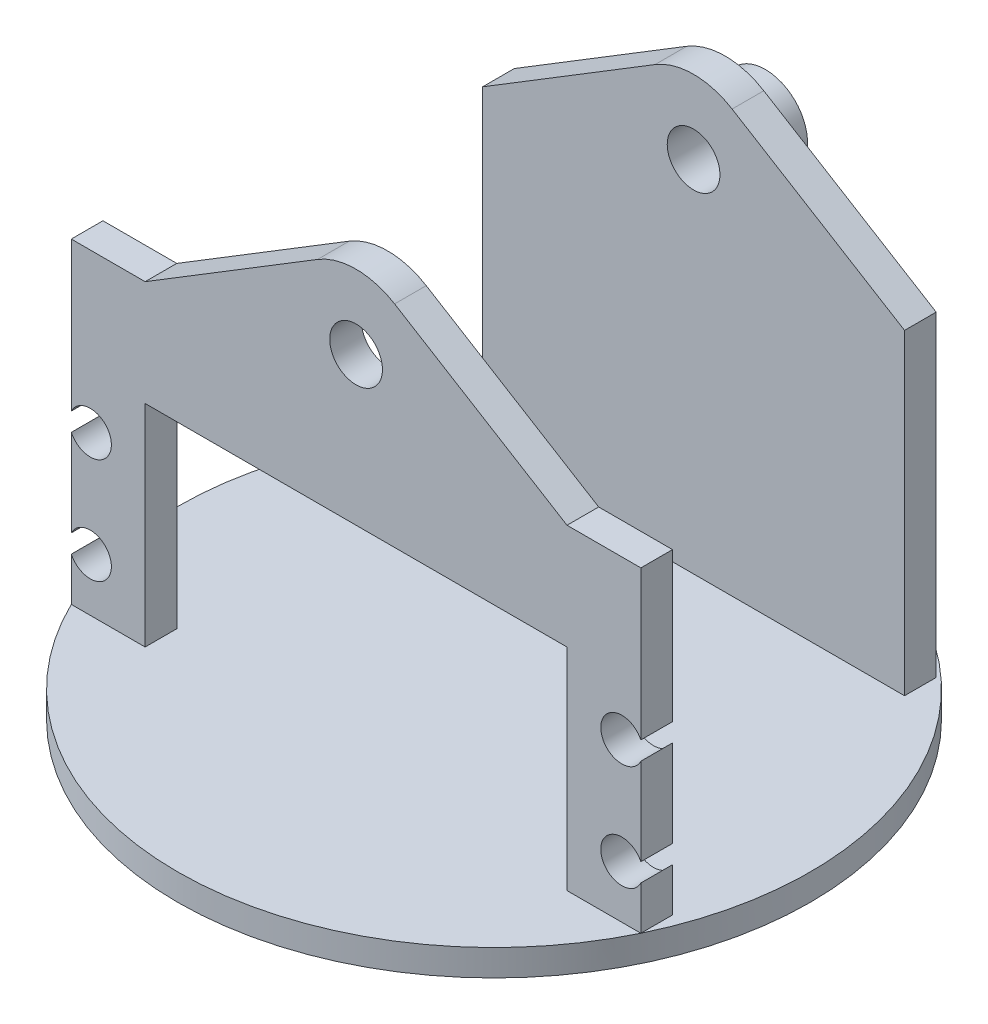
from build123d import *

# Parameters (mm, degrees)
CROQUIS2_W              = 54
CROQUIS2_H              = 3
SALIENTE_EXTRUIR1_DEPTH = 30
CORTAR_EXTRUIR1_REACH   = 63.478
CROQUIS3_W              = 40
CROQUIS3_H              = 20
CORTAR_EXTRUIR2_DEPTH   = 10
CROQUIS5_R              = 2.5
SALIENTE_EXTRUIR2_DEPTH = 3
CROQUIS6_R              = 2.5
SALIENTE_EXTRUIR3_DEPTH = 3
CROQUIS7_R              = 4
CROQUIS7_R_2            = 2.5
SALIENTE_EXTRUIR4_DEPTH = 1.8
CROQUIS8_R              = 4
SALIENTE_EXTRUIR5_DEPTH = 2


with BuildPart() as part:
    # Croquis1 → Revolución1 (revolve)
    with BuildSketch(Plane.XY):
        Polygon((0, 0), (0, 2), (-30, 2), (-30, -0.5), (-5.5, -0.5), (-5.5, -2.75), (-2.9, -2.75), (-2.9, 0), align=None)
    revolve(axis=Axis((0, 5.26927704, 0), (0, -1, 0)))

    # Croquis2 → Saliente-Extruir1 (add)
    with BuildSketch(Plane(origin=(0, 2, 0), x_dir=(1, 0, 0), z_dir=(0, 1, 0))):
        with Locations((0, -11.576696831)):
            Rectangle(CROQUIS2_W, CROQUIS2_H)
    extrude(amount=SALIENTE_EXTRUIR1_DEPTH)

    # Croquis3 → Cortar-Extruir1 (cut, up to next)
    with BuildSketch(Plane.XY.offset(13.076696831), mode=Mode.PRIVATE) as cortar_extruir1_sk1:
        with Locations((0, 12)):
            Rectangle(CROQUIS3_W, CROQUIS3_H)
    cortar_extruir1_tool1 = extrude(cortar_extruir1_sk1.sketch, amount=-CORTAR_EXTRUIR1_REACH, mode=Mode.PRIVATE) & part.part
    add(cortar_extruir1_tool1.solids().sort_by_distance((0, 12, 13.076697))[0], mode=Mode.SUBTRACT)

    # Croquis4 → Cortar-Extruir2 (cut)
    with BuildSketch(Plane.XY.offset(13.076696831)):
        with BuildLine():
            ThreePointArc((-23.2, 17), (-24.752786405, 18.949358869), (-27, 17.871779789))
            Line((-27, 17.871779789), (-27, 16.128220211))
            ThreePointArc((-27, 16.128220211), (-24.752786405, 15.050641131), (-23.2, 17))
        make_face()
        with BuildLine():
            Line((-27, 16.128220211), (-27, 17.871779789))
            ThreePointArc((-27, 17.871779789), (-27.2, 17), (-27, 16.128220211))
        make_face()
        with BuildLine():
            ThreePointArc((-27, 7.871779789), (-27.2, 7), (-27, 6.128220211))
            Line((-27, 6.128220211), (-27, 7.871779789))
        make_face()
        with BuildLine():
            Line((-27, 7.871779789), (-27, 6.128220211))
            ThreePointArc((-27, 6.128220211), (-24.752786405, 5.050641131), (-23.2, 7))
            ThreePointArc((-23.2, 7), (-24.752786405, 8.949358869), (-27, 7.871779789))
        make_face()
    cortar_extruir2 = extrude(amount=-CORTAR_EXTRUIR2_DEPTH, mode=Mode.SUBTRACT)

    # Simetría1: Cortar-Extruir2 across plane
    add(cortar_extruir2.mirror(Plane(origin=(0, 0, 0), x_dir=(0, 0, 1), z_dir=(1, 0, 0))), mode=Mode.SUBTRACT)

    # Croquis5 → Saliente-Extruir2 (add)
    with BuildSketch(Plane.XY.offset(13.076696831)):
        with BuildLine():
            Line((-20, 32), (-3.652825201, 42))
            ThreePointArc((-3.652825201, 42), (0, 43.028662792), (3.652825201, 42))
            Line((3.652825201, 42), (20, 32))
            Line((20, 32), (-20, 32))
        make_face()
        with Locations((0, 36.028662792)):
            Circle(CROQUIS5_R, mode=Mode.SUBTRACT)
    extrude(amount=-SALIENTE_EXTRUIR2_DEPTH)

    # Croquis6 → Saliente-Extruir3 (add)
    with BuildSketch(Plane(origin=(0, 0, -18.923303169), x_dir=(-1, 0, 0), z_dir=(0, 0, -1))):
        with BuildLine():
            Line((-20, 2), (-20, 32))
            Line((-20, 32), (-3.652825201, 42))
            ThreePointArc((-3.652825201, 42), (0, 43.028662792), (3.652825201, 42))
            Line((3.652825201, 42), (20, 32))
            Line((20, 32), (20, 2))
            Line((20, 2), (-20, 2))
        make_face()
        with Locations(Location((0, 36.028662792, 0), (0, 0, 180))):
            Circle(CROQUIS6_R, mode=Mode.SUBTRACT)
    extrude(amount=SALIENTE_EXTRUIR3_DEPTH)

    # Croquis7 → Saliente-Extruir4 (add)
    with BuildSketch(Plane(origin=(0, 0, -21.923303169), x_dir=(-1, 0, 0), z_dir=(0, 0, -1))):
        with Locations((0, 36.028662792)):
            Circle(CROQUIS7_R)
        with Locations(Location((0, 36.028662792, 0), (0, 0, 180))):
            Circle(CROQUIS7_R_2, mode=Mode.SUBTRACT)
    extrude(amount=SALIENTE_EXTRUIR4_DEPTH)

    # Croquis8 → Saliente-Extruir5 (add)
    with BuildSketch(Plane(origin=(0, 0, -23.723303169), x_dir=(-1, 0, 0), z_dir=(0, 0, -1))):
        with Locations((0, 36.028662792)):
            Circle(CROQUIS8_R)
    extrude(amount=SALIENTE_EXTRUIR5_DEPTH)


solid = part.part
